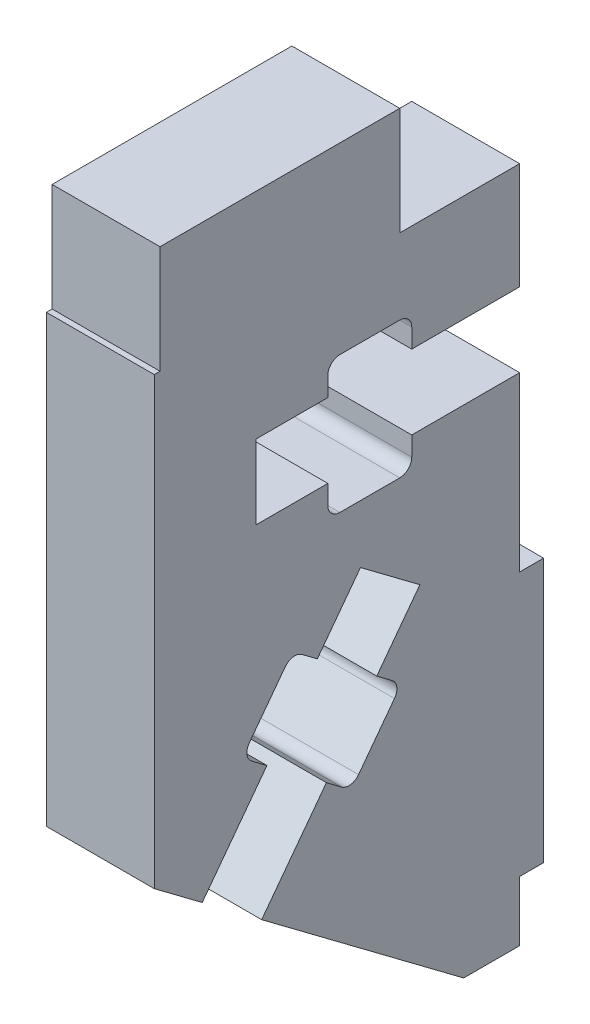
from build123d import *

# Parameters (mm, degrees)
BOSS_EXTRUDE1_DEPTH = 4.5
SKETCH2_W           = 1
SKETCH2_H           = 11
BOSS_EXTRUDE2_DEPTH = 4.5
CUT_EXTRUDE1_DEPTH  = 51.20209159
CUT_EXTRUDE2_DEPTH  = 51.20209159
CUT_EXTRUDE3_DEPTH  = 51.20209159
SKETCH8_W           = 10
SKETCH8_H           = 4.5
BOSS_EXTRUDE3_DEPTH = 4.5
CUT_EXTRUDE4_DEPTH  = 34.948602328


with BuildPart() as part:
    # Sketch1 → Boss-Extrude1 (new body)
    with BuildSketch(Plane(origin=(0, 0, 0), x_dir=(0, 0, -1), z_dir=(1, 0, 0))):
        Polygon((0, 0), (0, -30), (-40, 0), align=None)
    extrude(amount=BOSS_EXTRUDE1_DEPTH)

    # Sketch2 → Boss-Extrude2 (add, through all)
    with BuildSketch(Plane(origin=(4.5, 0, 0), x_dir=(0, 0, -1), z_dir=(1, 0, 0))):
        with Locations((0.5, -20.25)):
            Rectangle(SKETCH2_W, SKETCH2_H)
    extrude(amount=-BOSS_EXTRUDE2_DEPTH)

    # Sketch3 → Cut-Extrude1 (cut, through all)
    with BuildSketch(Plane(origin=(4.5, 0, 0), x_dir=(0, 0, -1), z_dir=(1, 0, 0))):
        with BuildLine():
            Line((0, -4.45), (-4.5, -4.45))
            Line((-4.5, -4.45), (-4.5, -3.65))
            ThreePointArc((-4.5, -3.65), (-4.646446609, -3.296446609), (-5, -3.15))
            Line((-5, -3.15), (-7.5, -3.15))
            ThreePointArc((-7.5, -3.15), (-7.853553391, -3.296446609), (-8, -3.65))
            Line((-8, -3.65), (-8, -4.45))
            Line((-8, -4.45), (-11, -4.45))
            Line((-11, -4.45), (-11, -7.55))
            Line((-11, -7.55), (-8, -7.55))
            Line((-8, -7.55), (-8, -8.35))
            ThreePointArc((-8, -8.35), (-7.853553391, -8.703553391), (-7.5, -8.85))
            Line((-7.5, -8.85), (-5, -8.85))
            ThreePointArc((-5, -8.85), (-4.646446609, -8.703553391), (-4.5, -8.35))
            Line((-4.5, -8.35), (-4.5, -7.55))
            Line((-4.5, -7.55), (0, -7.55))
            Line((0, -7.55), (0, -4.45))
        make_face()
    extrude(amount=-CUT_EXTRUDE1_DEPTH, mode=Mode.SUBTRACT)

    # Sketch4 → Cut-Extrude2 (cut, through all)
    with BuildSketch(Plane(origin=(4.5, 0, 0), x_dir=(0, 0, -1), z_dir=(1, 0, 0))):
        with BuildLine():
            Line((-10.76, -21.93), (-13.24, -20.07))
            Line((-13.24, -20.07), (-10.54, -16.47))
            Line((-10.54, -16.47), (-11.18, -15.99))
            ThreePointArc((-11.18, -15.99), (-11.374974747, -15.660710678), (-11.28, -15.29))
            Line((-11.28, -15.29), (-9.78, -13.29))
            ThreePointArc((-9.78, -13.29), (-9.450710678, -13.095025253), (-9.08, -13.19))
            Line((-9.08, -13.19), (-8.44, -13.67))
            Line((-8.44, -13.67), (-6.64, -11.27))
            Line((-6.64, -11.27), (-4.16, -13.13))
            Line((-4.16, -13.13), (-5.96, -15.53))
            Line((-5.96, -15.53), (-5.32, -16.01))
            ThreePointArc((-5.32, -16.01), (-5.125025253, -16.339289322), (-5.22, -16.71))
            Line((-5.22, -16.71), (-6.72, -18.71))
            ThreePointArc((-6.72, -18.71), (-7.049289322, -18.904974747), (-7.42, -18.81))
            Line((-7.42, -18.81), (-8.06, -18.33))
            Line((-8.06, -18.33), (-10.76, -21.93))
        make_face()
    extrude(amount=-CUT_EXTRUDE2_DEPTH, mode=Mode.SUBTRACT)

    # Sketch5 → Cut-Extrude3 (cut, through all)
    with BuildSketch(Plane(origin=(4.5, 0, 0), x_dir=(0, 0, -1), z_dir=(1, 0, 0))):
        Polygon((-15.24, -18.57), (-15.24, 0), (-40, 0), align=None)
    extrude(amount=-CUT_EXTRUDE3_DEPTH, mode=Mode.SUBTRACT)

    # Sketch8 → Boss-Extrude3 (add, through all)
    with BuildSketch(Plane(origin=(4.5, 0, 0), x_dir=(0, 0, -1), z_dir=(1, 0, 0))):
        with Locations((-10, 2.25)):
            Rectangle(SKETCH8_W, SKETCH8_H)
    extrude(amount=-BOSS_EXTRUDE3_DEPTH)

    # Sketch10 → Cut-Extrude4 (cut, through all)
    with BuildSketch(Plane(origin=(4.5, 0, 0), x_dir=(0, 0, -1), z_dir=(1, 0, 0))):
        Polygon((0, -28.25), (-2.333333333, -28.25), (0, -30), align=None)
    extrude(amount=-CUT_EXTRUDE4_DEPTH, mode=Mode.SUBTRACT)


solid = part.part
